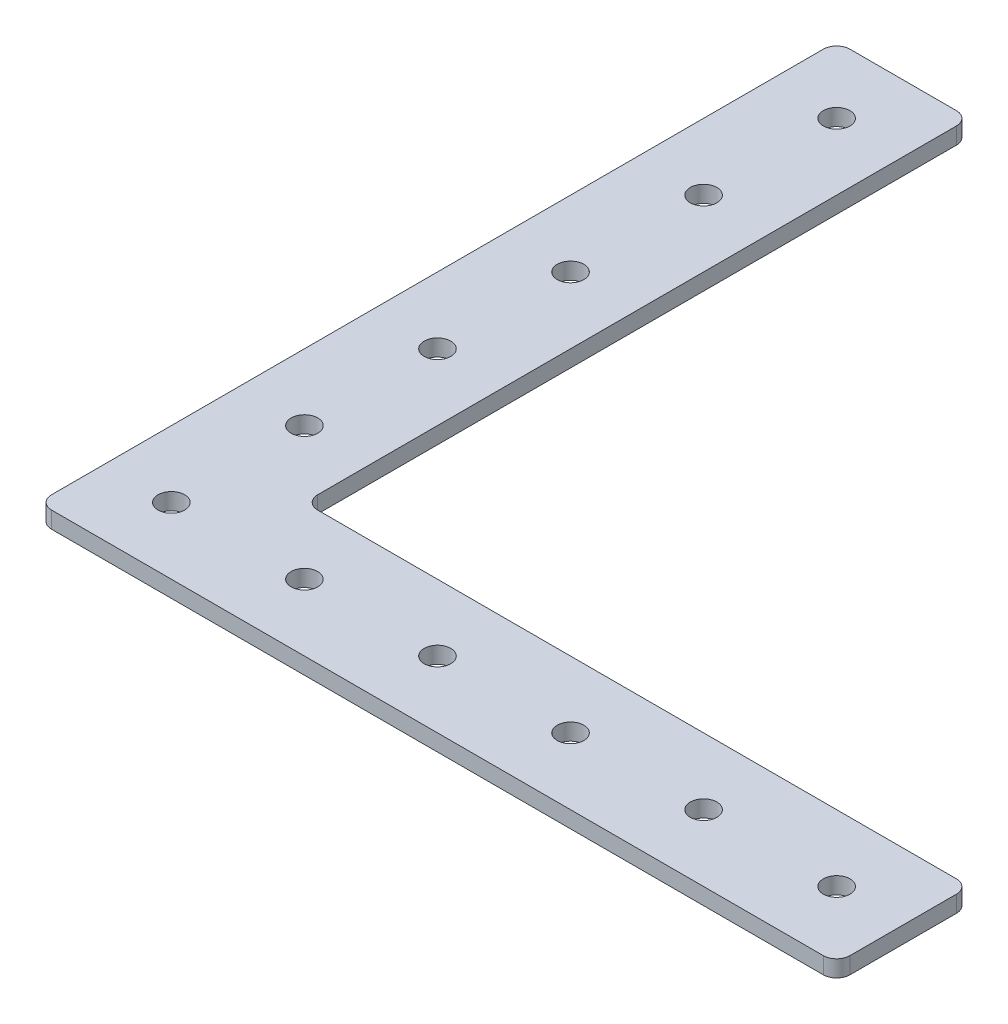
from build123d import *

# Parameters (mm, degrees)
BOSS_EXTRUDE1_DEPTH = 3.175
SKETCH2_R           = 2.54
CUT_EXTRUDE1_DEPTH  = 3.175
LPATTERN1_COUNT     = 6
LPATTERN1_PITCH     = 25.4
SKETCH3_R           = 2.54
CUT_EXTRUDE2_DEPTH  = 3.175
LPATTERN2_COUNT     = 5
LPATTERN2_PITCH     = 25.4


with BuildPart() as part:
    # Sketch1 → Boss-Extrude1 (new body)
    with BuildSketch(Plane(origin=(0, 0, 0), x_dir=(1, 0, 0), z_dir=(0, 1, 0))):
        with BuildLine():
            Line((0, -2.54), (0, -149.86))
            ThreePointArc((0, -149.86), (0.743948776, -151.656051224), (2.54, -152.4))
            Line((2.54, -152.4), (149.86, -152.4))
            ThreePointArc((149.86, -152.4), (151.656051224, -151.656051224), (152.4, -149.86))
            Line((152.4, -149.86), (152.4, -129.54))
            ThreePointArc((152.4, -129.54), (151.656051224, -127.743948776), (149.86, -127))
            Line((149.86, -127), (27.94, -127))
            ThreePointArc((27.94, -127), (26.143948776, -126.256051224), (25.4, -124.46))
            Line((25.4, -124.46), (25.4, -2.54))
            ThreePointArc((25.4, -2.54), (24.656051224, -0.743948776), (22.86, 0))
            Line((22.86, 0), (2.54, 0))
            ThreePointArc((2.54, 0), (0.743948776, -0.743948776), (0, -2.54))
        make_face()
    extrude(amount=BOSS_EXTRUDE1_DEPTH)

    # Sketch2 → Cut-Extrude1 (cut)
    with BuildSketch(Plane(origin=(0, 3.175, 0), x_dir=(1, 0, 0), z_dir=(0, 1, 0))):
        with Locations(Location((12.7, -12.7, 0), (0, 0, 270))):
            Circle(SKETCH2_R)
    cut_extrude1 = extrude(amount=-CUT_EXTRUDE1_DEPTH, mode=Mode.SUBTRACT)

    # LPattern1: Cut-Extrude1 ×6
    with Locations(*[(0, 0, i * LPATTERN1_PITCH) for i in range(1, LPATTERN1_COUNT)]):
        add(cut_extrude1, mode=Mode.SUBTRACT)

    # Sketch3 → Cut-Extrude2 (cut)
    with BuildSketch(Plane(origin=(0, 3.175, 0), x_dir=(1, 0, 0), z_dir=(0, 1, 0))):
        with Locations(Location((139.7, -139.7, 0), (0, 0, 270))):
            Circle(SKETCH3_R)
    cut_extrude2 = extrude(amount=-CUT_EXTRUDE2_DEPTH, mode=Mode.SUBTRACT)

    # LPattern2: Cut-Extrude2 ×5
    with Locations(*[(-i * LPATTERN2_PITCH, 0, 0) for i in range(1, LPATTERN2_COUNT)]):
        add(cut_extrude2, mode=Mode.SUBTRACT)


solid = part.part
